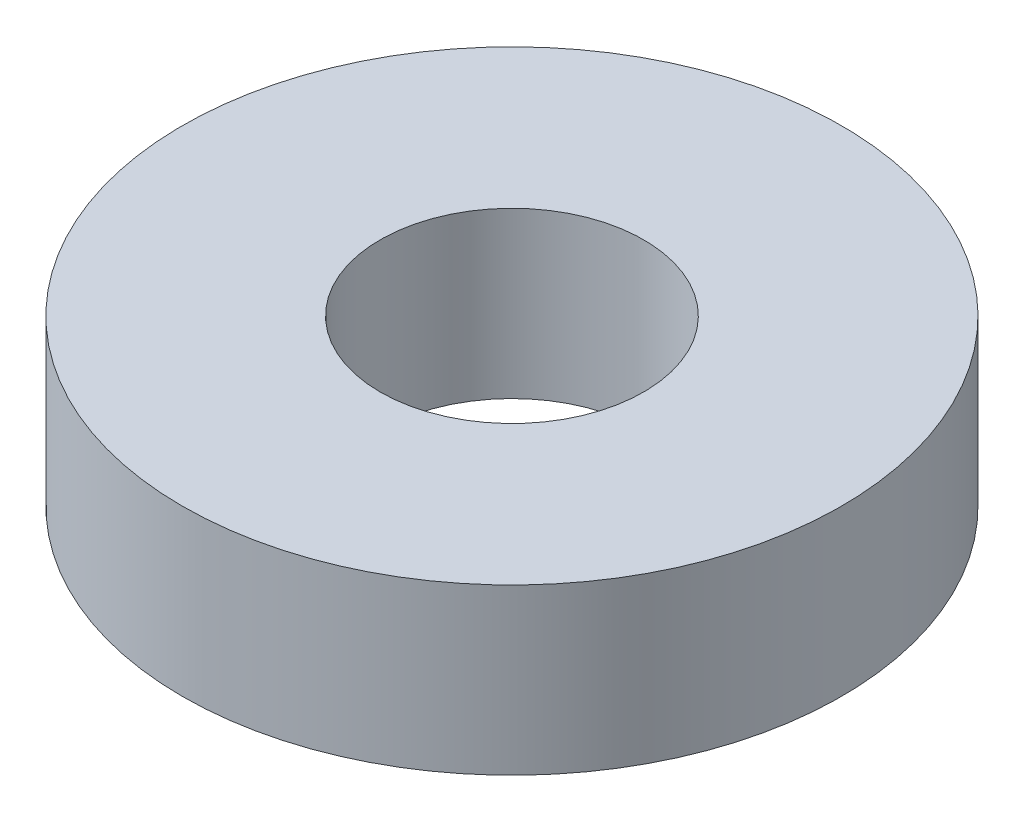
from build123d import *

# Parameters (mm, degrees)
SKETCH1_R           = 10
SKETCH1_R_2         = 4
BOSS_EXTRUDE1_DEPTH = 5


with BuildPart() as part:
    # Sketch1 → Boss-Extrude1 (new body)
    with BuildSketch(Plane(origin=(0, 0, 0), x_dir=(1, 0, 0), z_dir=(0, 1, 0))):
        with Locations(Location((0, 0, 0), (0, 0, 270))):
            Circle(SKETCH1_R)
        with Locations(Location((0, 0, 0), (0, 0, 270))):
            Circle(SKETCH1_R_2, mode=Mode.SUBTRACT)
    extrude(amount=BOSS_EXTRUDE1_DEPTH)


solid = part.part
